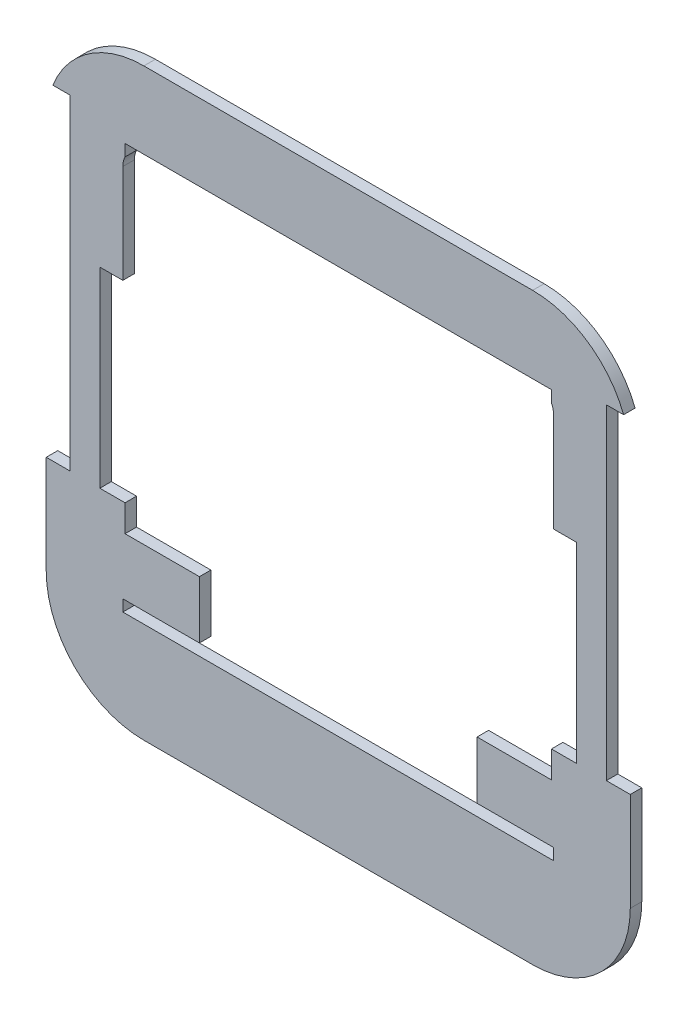
from build123d import *

# Parameters (mm, degrees)
BOSS_EXTRUDE1_DEPTH = 3


with BuildPart() as part:
    # Sketch1 → Boss-Extrude1 (new body)
    with BuildSketch(Plane.XY):
        with BuildLine():
            Line((76.25, -25), (70, -25))
            Line((70, -25), (70, 60))
            Line((70, 60), (74.513154252, 60))
            ThreePointArc((74.513154252, 60), (68.78122292, 68.78122292), (60, 74.513154252))
            ThreePointArc((60, 74.513154252), (58.514821012, 75.039041863), (57, 75.472206616))
            ThreePointArc((57, 75.472206616), (53.899105529, 76.05480457), (50.75, 76.25))
            Line((50.75, 76.25), (-50.75, 76.25))
            ThreePointArc((-50.75, 76.25), (-65.14400917, 71.79904986), (-74.513154252, 60))
            Line((-74.513154252, 60), (-70, 60))
            Line((-70, 60), (-70, -25))
            Line((-70, -25), (-76.25, -25))
            Line((-76.25, -25), (-76.25, -50.75))
            ThreePointArc((-76.25, -50.75), (-68.78122292, -68.78122292), (-50.75, -76.25))
            Line((-50.75, -76.25), (50.75, -76.25))
            ThreePointArc((50.75, -76.25), (68.78122292, -68.78122292), (76.25, -50.75))
            Line((76.25, -50.75), (76.25, -25))
        make_face()
        with BuildLine():
            Line((56.25, -50), (56.25, -47))
            Line((56.25, -47), (49.746794345, -47))
            Line((49.746794345, -47), (36.25, -47))
            Line((36.25, -47), (36.25, -32))
            Line((36.25, -32), (55.669788796, -32))
            Line((55.669788796, -32), (55.669788796, -25))
            Line((55.669788796, -25), (56.25, -25))
            Line((56.25, -25), (62.25, -25))
            Line((62.25, -25), (62.25, 25))
            Line((62.25, 25), (56.249999998, 25))
            Line((56.249999998, 25), (56.249999998, 50.75))
            ThreePointArc((56.249999998, 50.75), (56.102982269, 52.013163019), (55.669788794, 53.208796089))
            Line((55.669788794, 53.208796089), (55.669788794, 56.25))
            Line((55.669788794, 56.25), (-55.669788796, 56.25))
            Line((-55.669788796, 56.25), (-55.669788796, 53.208796089))
            ThreePointArc((-55.669788796, 53.208796089), (-56.10298227, 52.013163019), (-56.25, 50.75))
            Line((-56.25, 50.75), (-56.25, 25))
            Line((-56.25, 25), (-62.25, 25))
            Line((-62.25, 25), (-62.25, -25))
            Line((-62.25, -25), (-56.25, -25))
            Line((-56.25, -25), (-55.669788796, -25))
            Line((-55.669788796, -25), (-55.669788796, -32))
            Line((-55.669788796, -32), (-36.25, -32))
            Line((-36.25, -32), (-36.25, -47))
            Line((-36.25, -47), (-49.746794345, -47))
            Line((-49.746794345, -47), (-56.25, -47))
            Line((-56.25, -47), (-56.25, -50))
            Line((-56.25, -50), (-49.746794345, -50))
            Line((-49.746794345, -50), (49.746794345, -50))
            Line((49.746794345, -50), (56.25, -50))
        make_face(mode=Mode.SUBTRACT)
    extrude(amount=BOSS_EXTRUDE1_DEPTH)


solid = part.part
